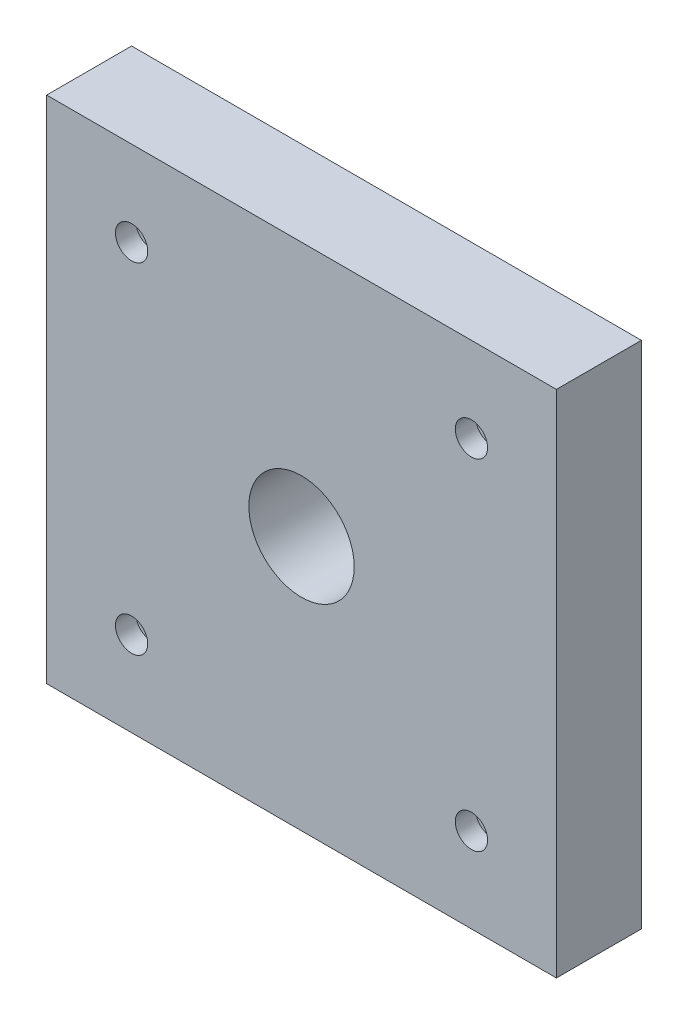
from build123d import *

# Parameters (mm, degrees)
SKETCH2_W           = 76.2
SKETCH2_H           = 76.2
SKETCH2_R           = 7.874
BOSS_EXTRUDE1_DEPTH = 12.7
SKETCH6_R           = 2.413
CUT_EXTRUDE3_DEPTH  = 3.048
SKETCH7_R           = 1.524
CUT_EXTRUDE4_DEPTH  = 55.739209932


with BuildPart() as part:
    # Sketch2 → Boss-Extrude1 (new body)
    with BuildSketch(Plane.XY):
        Rectangle(SKETCH2_W, SKETCH2_H)
        Circle(SKETCH2_R, mode=Mode.SUBTRACT)
    extrude(amount=BOSS_EXTRUDE1_DEPTH)

    # Sketch6 → Cut-Extrude3 (cut)
    with BuildSketch(Plane.XY.offset(12.7)):
        with Locations((-25.4, 25.4)):
            Circle(SKETCH6_R)
        with Locations((25.4, 25.4)):
            Circle(SKETCH6_R)
        with Locations((25.4, -25.4)):
            Circle(SKETCH6_R)
        with Locations((-25.4, -25.4)):
            Circle(SKETCH6_R)
    extrude(amount=-CUT_EXTRUDE3_DEPTH, mode=Mode.SUBTRACT)

    # Sketch7 → Cut-Extrude4 (cut, through all)
    with BuildSketch(Plane.XY.offset(9.652)):
        with Locations((-25.4, 25.4)):
            Circle(SKETCH7_R)
        with Locations((25.4, 25.4)):
            Circle(SKETCH7_R)
        with Locations((25.4, -25.4)):
            Circle(SKETCH7_R)
        with Locations((-25.4, -25.4)):
            Circle(SKETCH7_R)
    extrude(amount=-CUT_EXTRUDE4_DEPTH, mode=Mode.SUBTRACT)


solid = part.part
